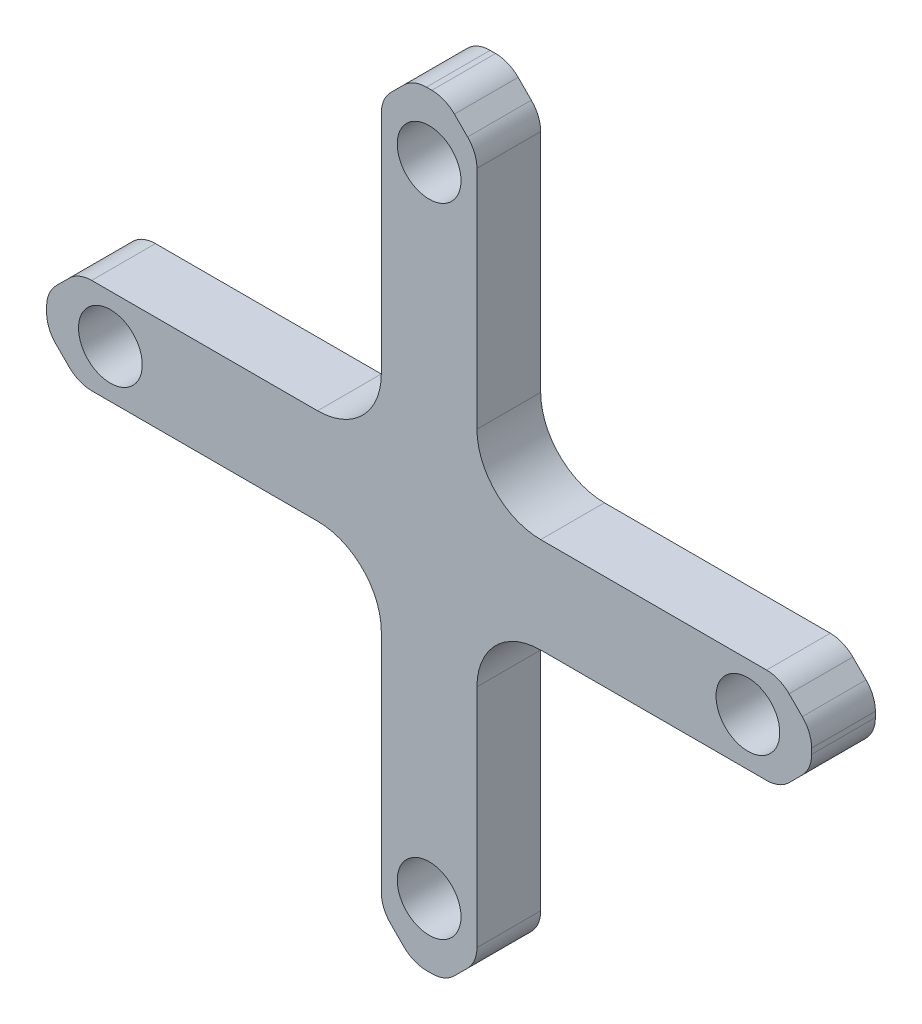
from build123d import *

# Parameters (mm, degrees)
SKETCH_1_R      = 10
EXTRUDE_3_DEPTH = 20


with BuildPart() as part:
    # Эскиз1 → Бобышка-Вытянуть3 (new body)
    with BuildSketch(Plane.XY):
        with BuildLine():
            Line((-15.578628424, 110.843660763), (-11.436492801, 114.985796387))
            ThreePointArc((-11.436492801, 114.985796387), (-8.192259312, 117.1535239), (-4.365424989, 117.914728575))
            Line((-4.365424989, 117.914728575), (-2.649696236, 117.914728575))
            ThreePointArc((-2.649696236, 117.914728575), (1.177138088, 117.1535239), (4.421371576, 114.985796387))
            Line((4.421371576, 114.985796387), (8.563507199, 110.843660763))
            ThreePointArc((8.563507199, 110.843660763), (10.731234713, 107.599427275), (11.492439388, 103.772592951))
            Line((11.492439388, 103.772592951), (11.492439388, 32.914728575))
            ThreePointArc((11.492439388, 32.914728575), (17.350303764, 18.772592951), (31.492439388, 12.914728575))
            Line((31.492439388, 12.914728575), (102.350303764, 12.914728575))
            ThreePointArc((102.350303764, 12.914728575), (106.177138088, 12.1535239), (109.421371576, 9.985796387))
            Line((109.421371576, 9.985796387), (113.563507199, 5.843660763))
            ThreePointArc((113.563507199, 5.843660763), (115.731234713, 2.599427275), (116.492439388, -1.227407049))
            Line((116.492439388, -1.227407049), (116.492439388, -2.943135801))
            ThreePointArc((116.492439388, -2.943135801), (115.731234713, -6.769970125), (113.563507199, -10.014203613))
            Line((113.563507199, -10.014203613), (109.421371576, -14.156339237))
            ThreePointArc((109.421371576, -14.156339237), (106.177138088, -16.32406675), (102.350303764, -17.085271425))
            Line((102.350303764, -17.085271425), (31.492439388, -17.085271425))
            ThreePointArc((31.492439388, -17.085271425), (17.350303764, -22.943135801), (11.492439388, -37.085271425))
            Line((11.492439388, -37.085271425), (11.492439388, -107.943135801))
            ThreePointArc((11.492439388, -107.943135801), (10.731234713, -111.769970125), (8.563507199, -115.014203613))
            Line((8.563507199, -115.014203613), (4.421371576, -119.156339237))
            ThreePointArc((4.421371576, -119.156339237), (1.177138088, -121.32406675), (-2.649696236, -122.085271425))
            Line((-2.649696236, -122.085271425), (-4.365424989, -122.085271425))
            ThreePointArc((-4.365424989, -122.085271425), (-8.192259312, -121.32406675), (-11.436492801, -119.156339237))
            Line((-11.436492801, -119.156339237), (-15.578628424, -115.014203613))
            ThreePointArc((-15.578628424, -115.014203613), (-17.746355937, -111.769970125), (-18.507560612, -107.943135801))
            Line((-18.507560612, -107.943135801), (-18.507560612, -37.085271425))
            ThreePointArc((-18.507560612, -37.085271425), (-24.365424989, -22.943135801), (-38.507560612, -17.085271425))
            Line((-38.507560612, -17.085271425), (-109.365424989, -17.085271425))
            ThreePointArc((-109.365424989, -17.085271425), (-113.192259312, -16.32406675), (-116.436492801, -14.156339237))
            Line((-116.436492801, -14.156339237), (-120.578628424, -10.014203613))
            ThreePointArc((-120.578628424, -10.014203613), (-122.746355937, -6.769970125), (-123.507560612, -2.943135801))
            Line((-123.507560612, -2.943135801), (-123.507560612, -1.227407049))
            ThreePointArc((-123.507560612, -1.227407049), (-122.746355937, 2.599427275), (-120.578628424, 5.843660763))
            Line((-120.578628424, 5.843660763), (-116.436492801, 9.985796387))
            ThreePointArc((-116.436492801, 9.985796387), (-113.192259312, 12.1535239), (-109.365424989, 12.914728575))
            Line((-109.365424989, 12.914728575), (-38.507560612, 12.914728575))
            ThreePointArc((-38.507560612, 12.914728575), (-24.365424989, 18.772592951), (-18.507560612, 32.914728575))
            Line((-18.507560612, 32.914728575), (-18.507560612, 103.772592951))
            ThreePointArc((-18.507560612, 103.772592951), (-17.746355937, 107.599427275), (-15.578628424, 110.843660763))
        make_face()
        with Locations((-103.507560612, -2.085271425)):
            Circle(SKETCH_1_R, mode=Mode.SUBTRACT)
        with Locations((-3.507560612, 97.914728575)):
            Circle(SKETCH_1_R, mode=Mode.SUBTRACT)
        with Locations((96.492439388, -2.085271425)):
            Circle(SKETCH_1_R, mode=Mode.SUBTRACT)
        with Locations((-3.507560612, -102.085271425)):
            Circle(SKETCH_1_R, mode=Mode.SUBTRACT)
    extrude(amount=EXTRUDE_3_DEPTH)


solid = part.part
